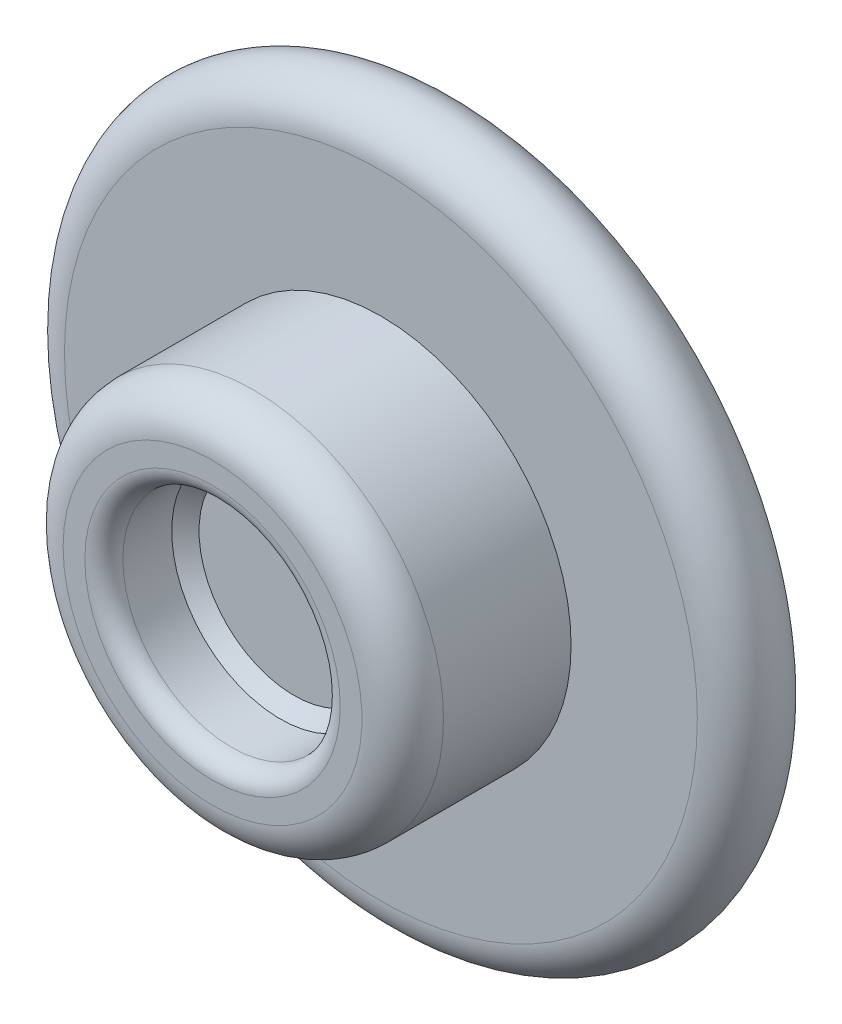
from build123d import *

# Parameters (mm, degrees)
REDONDEO3_R           = 0.7
REDONDEO5_R           = 1.5
CROQUIS2_R            = 2.5
CROQUIS2_R_2          = 1.5
CORTAR_EXTRUIR1_DEPTH = 3
CORTAR_EXTRUIR3_DEPTH = 3


with BuildPart() as part:
    # Croquis1 → Revolución1 (revolve)
    with BuildSketch(Plane(origin=(0, 0, 0), x_dir=(0, 0, -1), z_dir=(1, 0, 0)), mode=Mode.PRIVATE) as revoluci_n1_sk:
        with BuildLine():
            Line((10.5, 4), (12.997954185, 4))
            Line((12.997954185, 4), (13.5, 3.497954185))
            Line((13.5, 3.497954185), (13.5, 0))
            Line((13.5, 0), (25.5, 0))
            ThreePointArc((25.5, 0), (25.166294504, 2.428032035), (24.189924541, 4.676009041))
            Line((24.189924541, 4.676009041), (16.696080767, 17))
            Line((16.696080767, 17), (16.696080767, 7))
            Line((16.696080767, 7), (10.5, 7))
            Line((10.5, 7), (10.5, 4))
        make_face()
    revolve(revoluci_n1_sk.sketch.rotate(Axis((0, 0, 43.421280629), (0, 0, -1)), 90), axis=Axis((0, 0, 43.421280629), (0, 0, -1)))

    # Redondeo3
    redondeo3_edges = [part.edges().sort_by_distance(p)[0] for p in [
        (-4, 0, -10.5),
    ]]
    fillet(redondeo3_edges, radius=REDONDEO3_R)

    # Redondeo5
    redondeo5_edges = [part.edges().sort_by_distance(p)[0] for p in [
        (-17, 0, -16.696080767),
        (-7, 0, -10.5),
    ]]
    fillet(redondeo5_edges, radius=REDONDEO5_R)

    # Croquis2 → Cortar-Extruir1 (cut)
    # profile 1 of 5: a face of its own
    with BuildSketch(Plane(origin=(0, 0, -25.5), x_dir=(-1, 0, 0), z_dir=(0, 0, -1))):
        Circle(CROQUIS2_R)
        Circle(CROQUIS2_R_2, mode=Mode.SUBTRACT)
    # profile 2 of 5: a face of its own
    with BuildSketch(Plane(origin=(0, 0, -25.5), x_dir=(-1, 0, 0), z_dir=(0, 0, -1))):
        with BuildLine():
            Line((-0.35, 2.677218706), (0.557333453, 4.114836877))
            Line((0.557333453, 4.114836877), (-0.216020438, 3.677218706))
            Line((-0.216020438, 3.677218706), (1.01365522, 5.207218706))
            Line((1.01365522, 5.207218706), (0.420313019, 4.267101787))
            Line((0.420313019, 4.267101787), (0.85, 4.510248984))
            Line((0.85, 4.510248984), (0.35, 2.677218706))
            ThreePointArc((0.35, 2.677218706), (0, 2.7), (-0.35, 2.677218706))
        make_face()
    # profile 3 of 5: a face of its own
    with BuildSketch(Plane(origin=(0, 0, -25.5), x_dir=(-1, 0, 0), z_dir=(0, 0, -1))):
        with BuildLine():
            Line((4.510248984, -0.85), (2.677218706, -0.35))
            ThreePointArc((2.677218706, -0.35), (2.7, 0), (2.677218706, 0.35))
            Line((2.677218706, 0.35), (4.114836877, -0.557333453))
            Line((4.114836877, -0.557333453), (3.677218706, 0.216020438))
            Line((3.677218706, 0.216020438), (5.207218706, -1.01365522))
            Line((5.207218706, -1.01365522), (4.267101787, -0.420313019))
            Line((4.267101787, -0.420313019), (4.510248984, -0.85))
        make_face()
    # profile 4 of 5: a face of its own
    with BuildSketch(Plane(origin=(0, 0, -25.5), x_dir=(-1, 0, 0), z_dir=(0, 0, -1))):
        with BuildLine():
            Line((-0.85, -4.510248984), (-0.35, -2.677218706))
            ThreePointArc((-0.35, -2.677218706), (0, -2.7), (0.35, -2.677218706))
            Line((0.35, -2.677218706), (-0.557333453, -4.114836877))
            Line((-0.557333453, -4.114836877), (0.216020438, -3.677218706))
            Line((0.216020438, -3.677218706), (-1.01365522, -5.207218706))
            Line((-1.01365522, -5.207218706), (-0.420313019, -4.267101787))
            Line((-0.420313019, -4.267101787), (-0.85, -4.510248984))
        make_face()
    # profile 5 of 5: a face of its own
    with BuildSketch(Plane(origin=(0, 0, -25.5), x_dir=(-1, 0, 0), z_dir=(0, 0, -1))):
        with BuildLine():
            Line((-4.510248984, 0.85), (-2.677218706, 0.35))
            ThreePointArc((-2.677218706, 0.35), (-2.7, 0), (-2.677218706, -0.35))
            Line((-2.677218706, -0.35), (-4.114836877, 0.557333453))
            Line((-4.114836877, 0.557333453), (-3.677218706, -0.216020438))
            Line((-3.677218706, -0.216020438), (-5.207218706, 1.01365522))
            Line((-5.207218706, 1.01365522), (-4.267101787, 0.420313019))
            Line((-4.267101787, 0.420313019), (-4.510248984, 0.85))
        make_face()
    extrude(amount=-CORTAR_EXTRUIR1_DEPTH, mode=Mode.SUBTRACT)

    # Croquis3 → Cortar-Extruir3 (cut)
    with BuildSketch(Plane.XY.offset(-23.77)):
        with BuildLine():
            Line((-0.35, 6.666828085), (0.557333453, 8.104446256))
            Line((0.557333453, 8.104446256), (-0.216020438, 7.666828085))
            Line((-0.216020438, 7.666828085), (1.01365522, 9.196828085))
            Line((1.01365522, 9.196828085), (0.420313019, 8.256711166))
            Line((0.420313019, 8.256711166), (0.85, 8.499858363))
            Line((0.85, 8.499858363), (0.35, 6.666828085))
            ThreePointArc((0.35, 6.666828085), (0, 6.676009041), (-0.35, 6.666828085))
        make_face()
        with BuildLine():
            Line((3.63550728, 5.599302058), (5.214566222, 6.229042367))
            Line((5.214566222, 6.229042367), (4.331684274, 6.329567842))
            Line((4.331684274, 6.329567842), (6.225824216, 6.844578626))
            Line((6.225824216, 6.844578626), (5.193213431, 6.432765857))
            Line((5.193213431, 6.432765857), (5.683755838, 6.376912401))
            Line((5.683755838, 6.376912401), (4.201819176, 5.187852381))
            ThreePointArc((4.201819176, 5.187852381), (3.924059658, 5.401004769), (3.63550728, 5.599302058))
        make_face()
        with BuildLine():
            Line((6.232374345, 2.393032958), (7.880011931, 1.974356011))
            Line((7.880011931, 1.974356011), (7.224832823, 2.574627817))
            Line((7.224832823, 2.574627817), (9.059939969, 1.87793277))
            Line((9.059939969, 1.87793277), (7.982482824, 2.151722632))
            Line((7.982482824, 2.151722632), (8.346510129, 1.818202645))
            Line((8.346510129, 1.818202645), (6.448686241, 1.727293396))
            ThreePointArc((6.448686241, 1.727293396), (6.349261901, 2.063000248), (6.232374345, 2.393032958))
        make_face()
        with BuildLine():
            Line((6.448686241, -1.727293396), (7.535560914, -3.034467235))
            Line((7.535560914, -3.034467235), (7.358340796, -2.163732526))
            Line((7.358340796, -2.163732526), (8.43346659, -3.806019575))
            Line((8.43346659, -3.806019575), (7.722715092, -2.951205504))
            Line((7.722715092, -2.951205504), (7.821181238, -3.434998723))
            Line((7.821181238, -3.434998723), (6.232374345, -2.393032958))
            ThreePointArc((6.232374345, -2.393032958), (6.349261901, -2.063000248), (6.448686241, -1.727293396))
        make_face()
        with BuildLine():
            Line((4.201819176, -5.187852381), (4.312781752, -6.884227135))
            Line((4.312781752, -6.884227135), (4.681212686, -6.075620586))
            Line((4.681212686, -6.075620586), (4.585695617, -8.036201804))
            Line((4.585695617, -8.036201804), (4.513132681, -6.926873445))
            Line((4.513132681, -6.926873445), (4.308426947, -7.37614733))
            Line((4.308426947, -7.37614733), (3.63550728, -5.599302058))
            ThreePointArc((3.63550728, -5.599302058), (3.924059658, -5.401004769), (4.201819176, -5.187852381))
        make_face()
        with BuildLine():
            Line((0.35, -6.666828085), (-0.557333453, -8.104446256))
            Line((-0.557333453, -8.104446256), (0.216020438, -7.666828085))
            Line((0.216020438, -7.666828085), (-1.01365522, -9.196828085))
            Line((-1.01365522, -9.196828085), (-0.420313019, -8.256711166))
            Line((-0.420313019, -8.256711166), (-0.85, -8.499858363))
            Line((-0.85, -8.499858363), (-0.35, -6.666828085))
            ThreePointArc((-0.35, -6.666828085), (0, -6.676009041), (0.35, -6.666828085))
        make_face()
        with BuildLine():
            Line((-3.63550728, -5.599302058), (-5.214566222, -6.229042367))
            Line((-5.214566222, -6.229042367), (-4.331684274, -6.329567842))
            Line((-4.331684274, -6.329567842), (-6.225824216, -6.844578626))
            Line((-6.225824216, -6.844578626), (-5.193213431, -6.432765857))
            Line((-5.193213431, -6.432765857), (-5.683755838, -6.376912401))
            Line((-5.683755838, -6.376912401), (-4.201819176, -5.187852381))
            ThreePointArc((-4.201819176, -5.187852381), (-3.924059658, -5.401004769), (-3.63550728, -5.599302058))
        make_face()
        with BuildLine():
            Line((-6.232374345, -2.393032958), (-7.880011931, -1.974356011))
            Line((-7.880011931, -1.974356011), (-7.224832823, -2.574627817))
            Line((-7.224832823, -2.574627817), (-9.059939969, -1.87793277))
            Line((-9.059939969, -1.87793277), (-7.982482824, -2.151722632))
            Line((-7.982482824, -2.151722632), (-8.346510129, -1.818202645))
            Line((-8.346510129, -1.818202645), (-6.448686241, -1.727293396))
            ThreePointArc((-6.448686241, -1.727293396), (-6.349261901, -2.063000248), (-6.232374345, -2.393032958))
        make_face()
        with BuildLine():
            Line((-6.448686241, 1.727293396), (-7.535560914, 3.034467235))
            Line((-7.535560914, 3.034467235), (-7.358340796, 2.163732526))
            Line((-7.358340796, 2.163732526), (-8.43346659, 3.806019575))
            Line((-8.43346659, 3.806019575), (-7.722715092, 2.951205504))
            Line((-7.722715092, 2.951205504), (-7.821181238, 3.434998723))
            Line((-7.821181238, 3.434998723), (-6.232374345, 2.393032958))
            ThreePointArc((-6.232374345, 2.393032958), (-6.349261901, 2.063000248), (-6.448686241, 1.727293396))
        make_face()
        with BuildLine():
            Line((-4.201819176, 5.187852381), (-4.312781752, 6.884227135))
            Line((-4.312781752, 6.884227135), (-4.681212686, 6.075620586))
            Line((-4.681212686, 6.075620586), (-4.585695617, 8.036201804))
            Line((-4.585695617, 8.036201804), (-4.513132681, 6.926873445))
            Line((-4.513132681, 6.926873445), (-4.308426947, 7.37614733))
            Line((-4.308426947, 7.37614733), (-3.63550728, 5.599302058))
            ThreePointArc((-3.63550728, 5.599302058), (-3.924059658, 5.401004769), (-4.201819176, 5.187852381))
        make_face()
    extrude(amount=CORTAR_EXTRUIR3_DEPTH, mode=Mode.SUBTRACT)


solid = part.part
